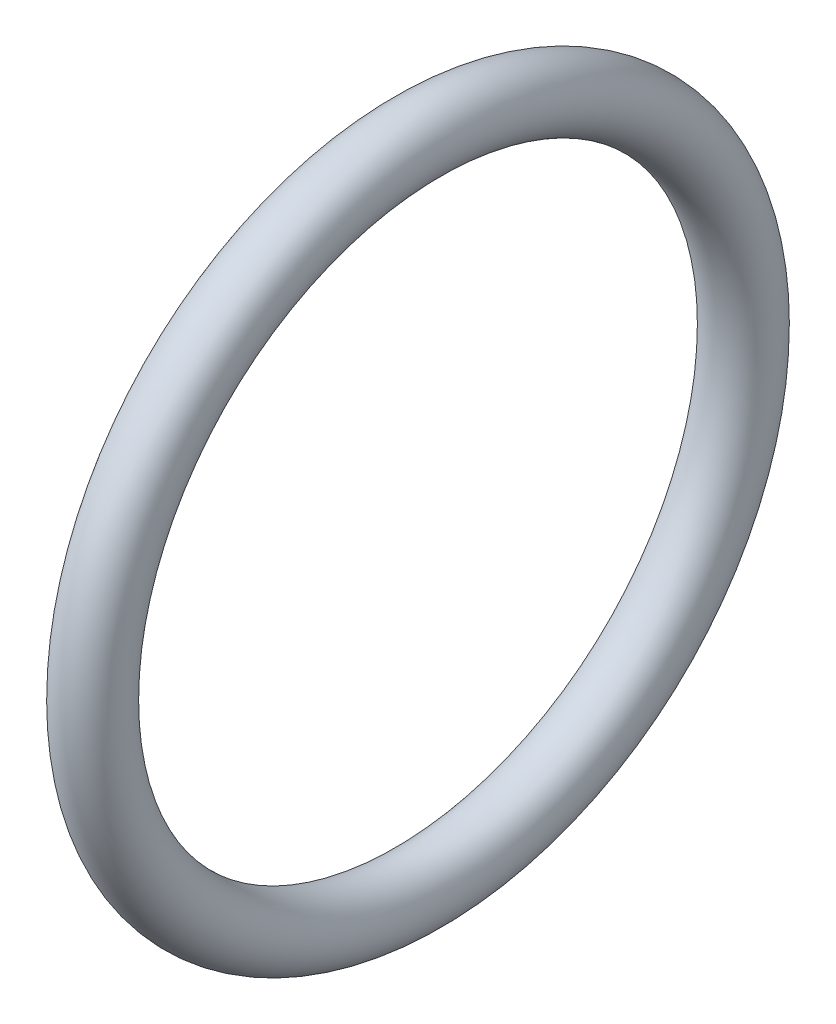
from build123d import *

# Parameters (mm, degrees)
ESQUISSE1_R = 1.6


with BuildPart() as part:
    # Esquisse1 → Révolution1 (revolve)
    with BuildSketch(Plane.XY, mode=Mode.PRIVATE) as r_volution1_sk:
        with Locations((0, 16)):
            Circle(ESQUISSE1_R)
    revolve(r_volution1_sk.sketch.rotate(Axis((-25.855836454, 0, 0), (1, 0, 0)), 90), axis=Axis((-25.855836454, 0, 0), (1, 0, 0)))


solid = part.part
